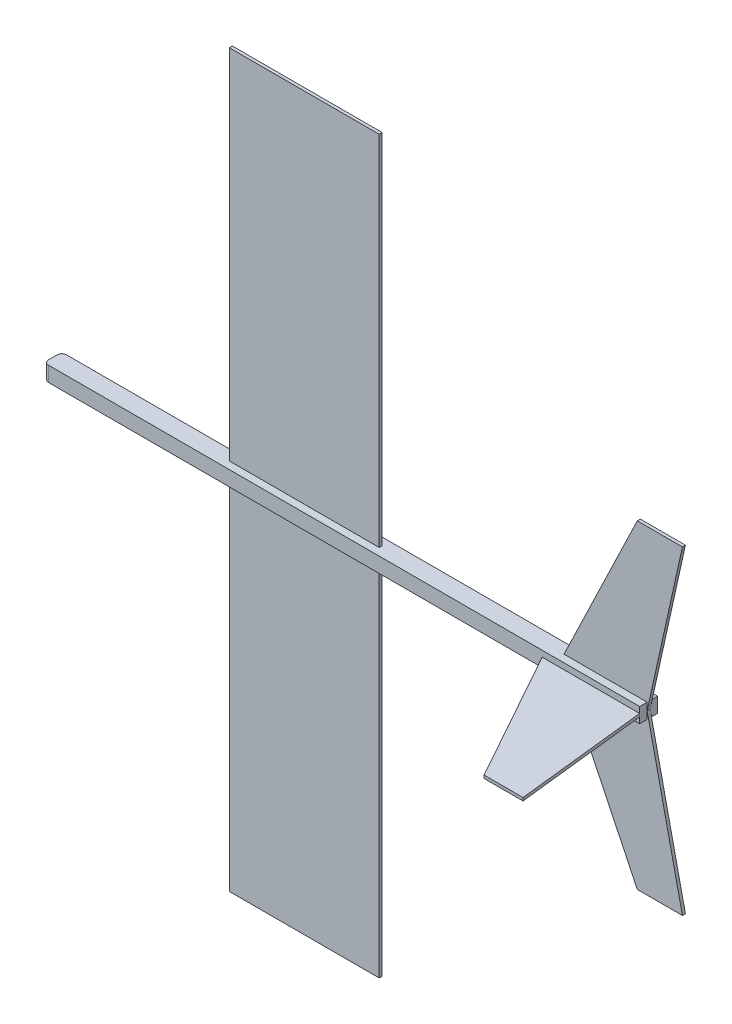
from build123d import *

# Parameters (mm, degrees)
SKETCH1_W           = 318
SKETCH1_H           = 8
BOSS_EXTRUDE1_DEPTH = 4.8
SKETCH3_W           = 80
SKETCH3_H           = 195
BOSS_EXTRUDE2_DEPTH = 0.79375
BOSS_EXTRUDE3_DEPTH = 0.79375
BOSS_EXTRUDE4_DEPTH = 0.79375
FILLET1_R           = 2.5


with BuildPart() as part:
    # Sketch1 → Boss-Extrude1 (new, symmetric)
    with BuildSketch(Plane.XY):
        Rectangle(SKETCH1_W, SKETCH1_H)
    extrude(amount=BOSS_EXTRUDE1_DEPTH, both=True)

    # Sketch3 → Boss-Extrude2 (add, symmetric)
    with BuildSketch(Plane.XY):
        with Locations((-24, 97.5)):
            Rectangle(SKETCH3_W, SKETCH3_H)
    boss_extrude2 = extrude(amount=BOSS_EXTRUDE2_DEPTH, both=True)

    # Mirror1: Boss-Extrude2 across plane
    add(boss_extrude2.mirror(Plane.ZX))

    # Sketch6 → Boss-Extrude3 (add, symmetric)
    with BuildSketch(Plane(origin=(0, 0, 0), x_dir=(1, 0, 0), z_dir=(0, 1, 0))):
        Polygon((159, -4.8), (166.766007972, -74.8), (145.966007972, -74.8), (107, -4.8), align=None)
    extrude(amount=BOSS_EXTRUDE3_DEPTH, both=True)

    # Sketch8 → Boss-Extrude4 (add, symmetric)
    with BuildSketch(Plane.XY):
        Polygon((159, 0), (177.834948036, 85.2), (153.758948036, 85.2), (112.7, 0), align=None)
    boss_extrude4 = extrude(amount=BOSS_EXTRUDE4_DEPTH, both=True)

    # Mirror2: Boss-Extrude4 across plane
    add(boss_extrude4.mirror(Plane.ZX))

    # Fillet1
    fillet1_edges = [part.edges().sort_by_distance(p)[0] for p in [
        (-159, 0, 4.8),
        (-159, 0, -4.8),
    ]]
    fillet(fillet1_edges, radius=FILLET1_R)


solid = part.part
